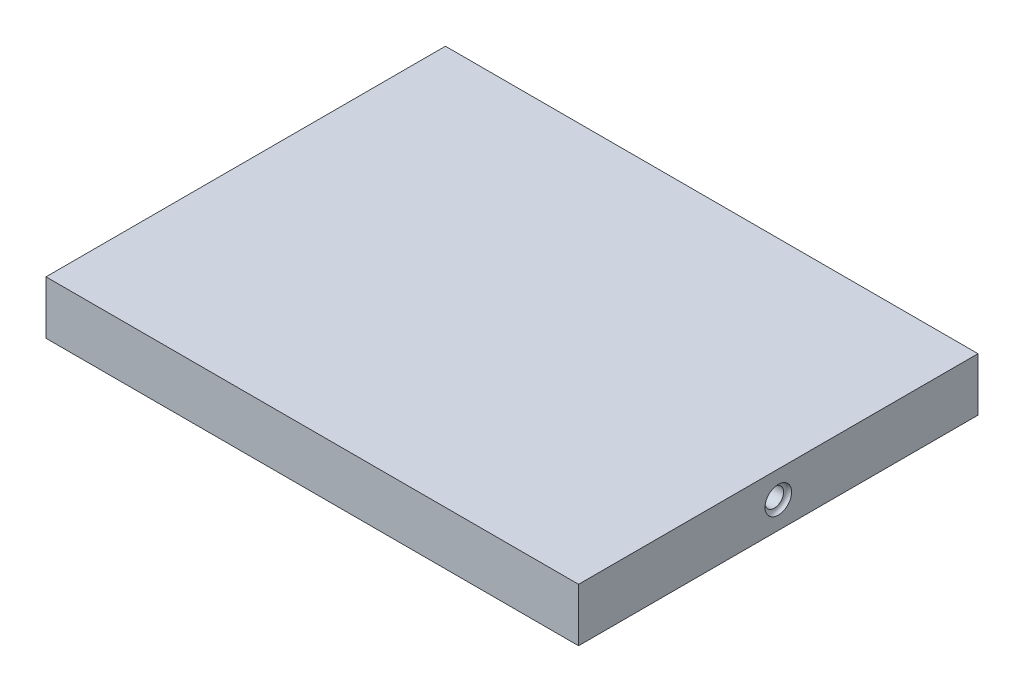
from build123d import *

# Parameters (mm, degrees)
SKETCH1_W           = 20
SKETCH1_H           = 15
BOSS_EXTRUDE1_DEPTH = 2


with BuildPart() as part:
    # Sketch1 → Boss-Extrude1 (new body)
    with BuildSketch(Plane(origin=(0, 0, 0), x_dir=(1, 0, 0), z_dir=(0, 1, 0))):
        Rectangle(SKETCH1_W, SKETCH1_H)
    extrude(amount=BOSS_EXTRUDE1_DEPTH)

    # Sketch2 → Cut-Revolve1 (revolve, cut)
    with BuildSketch(Plane.XY, mode=Mode.PRIVATE) as cut_revolve1_sk:
        with BuildLine():
            Line((-10, 1), (10, 1))
            Line((10, 1), (10, 1.5))
            ThreePointArc((10, 1.5), (9.893933983, 1.456066017), (9.85, 1.35))
            Line((9.85, 1.35), (3.4, 1.35))
            ThreePointArc((3.4, 1.35), (3, 1.75), (2.6, 1.35))
            Line((2.6, 1.35), (-2.6, 1.35))
            ThreePointArc((-2.6, 1.35), (-3, 1.75), (-3.4, 1.35))
            Line((-3.4, 1.35), (-9.85, 1.35))
            ThreePointArc((-9.85, 1.35), (-9.893933983, 1.456066017), (-10, 1.5))
            Line((-10, 1.5), (-10, 1))
        make_face()
    revolve(cut_revolve1_sk.sketch.rotate(Axis((-10, 1, 0), (1, 0, 0)), 90), axis=Axis((-10, 1, 0), (1, 0, 0)), mode=Mode.SUBTRACT)


solid = part.part
